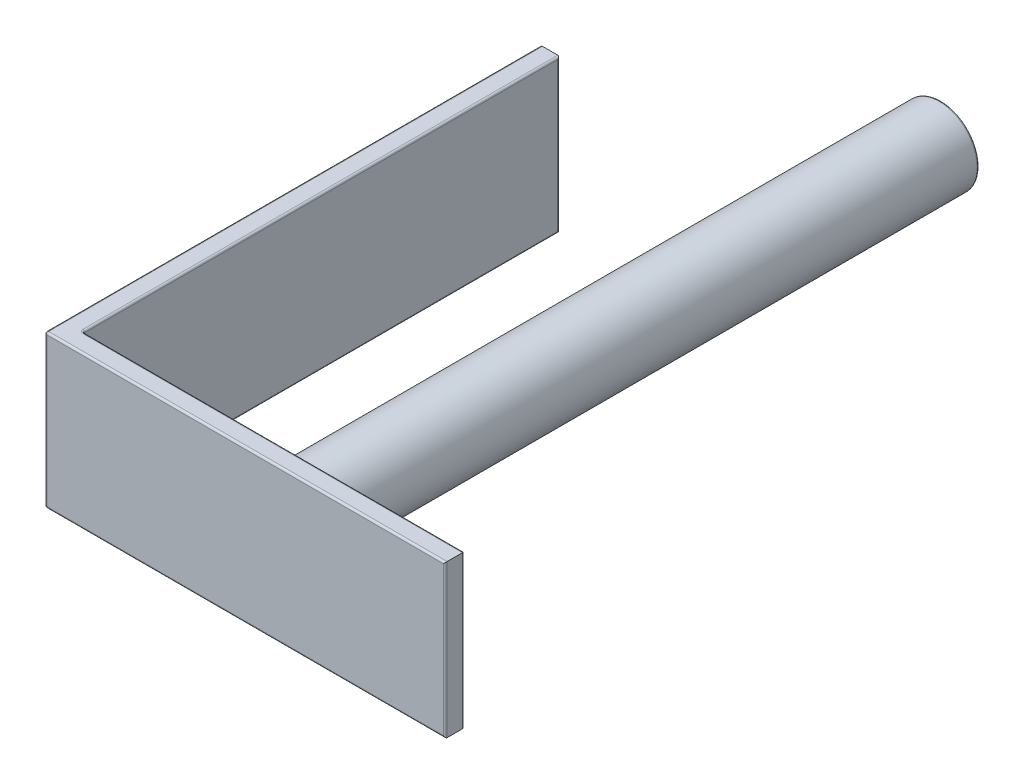
from build123d import *

# Parameters (mm, degrees)
SKETCH1_R           = 50.8
BOSS_EXTRUDE1_DEPTH = 889
EXTRUDE_THIN1_DEPTH = 101.6
FILLET1_R           = 2.54


with BuildPart() as part:
    # Sketch1 → Boss-Extrude1 (new body)
    with BuildSketch(Plane.XY):
        Circle(SKETCH1_R)
    extrude(amount=-BOSS_EXTRUDE1_DEPTH)

    # Sketch3 → Extrude-Thin1 (add, symmetric)
    with BuildSketch(Plane(origin=(0, 0, 0), x_dir=(1, 0, 0), z_dir=(0, 1, 0))):
        Polygon((254, 0), (-254, 0), (-254, 635), (-279.4, 635), (-279.4, -25.4), (254, -25.4), align=None)
    extrude(amount=EXTRUDE_THIN1_DEPTH, both=True)

    # Fillet1
    fillet1_edges = [part.edges().sort_by_distance(p)[0] for p in [
        (-50.8, 0, 0),
        (-50.8, 0, -889),
        (-254, -101.6, -317.5),
        (-254, 0, 0),
        (-254, 0, -635),
        (-279.4, 101.6, -304.8),
        (-279.4, 0, -635),
        (-12.7, 101.6, 25.4),
        (-279.4, 0, 25.4),
        (254, 0, 25.4),
        (0, -101.6, 0),
        (254, 0, 0),
        (-254, 101.6, -317.5),
        (0, 101.6, 0),
        (-12.7, -101.6, 25.4),
        (-279.4, -101.6, -304.8),
    ]]
    fillet(fillet1_edges, radius=FILLET1_R)


solid = part.part
